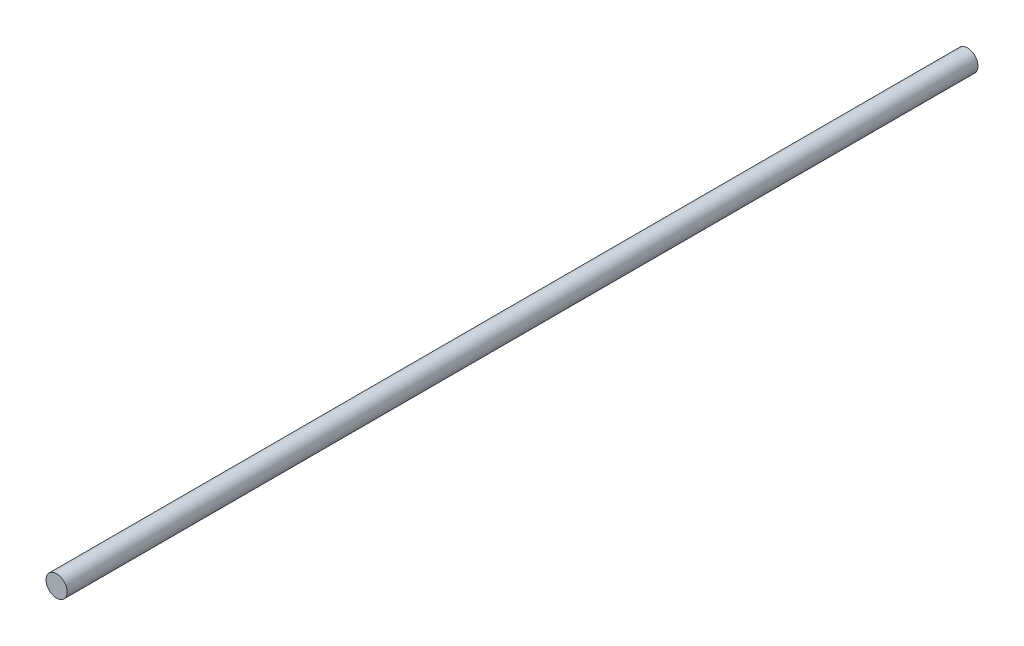
from build123d import *

# Parameters (mm, degrees)
SKETCH1_R           = 2.5
BOSS_EXTRUDE1_DEPTH = 215


with BuildPart() as part:
    # Sketch1 → Boss-Extrude1 (new body)
    with BuildSketch(Plane.XY):
        Circle(SKETCH1_R)
    extrude(amount=BOSS_EXTRUDE1_DEPTH)


solid = part.part
